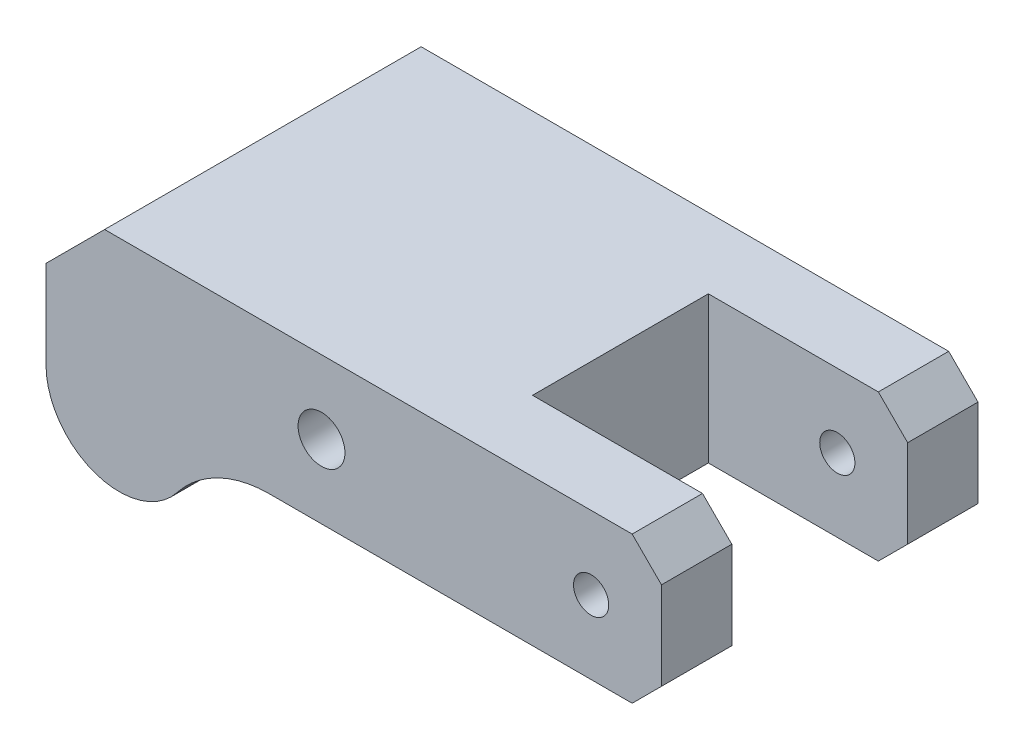
from build123d import *

# Parameters (mm, degrees)
ESTRUSIONE_ESTRUSIONE1_DEPTH = 27
SMUSSO1_SIZE                 = 10
SMUSSO2_SIZE                 = 5
SCHIZZO2_W                   = 34
SCHIZZO2_H                   = 30
TAGLIO_ESTRUSIONE1_DEPTH     = 86.181546674
SCHIZZO3_R                   = 3
SCHIZZO3_R_2                 = 4
TAGLIO_ESTRUSIONE2_DEPTH     = 94.067963842


with BuildPart() as part:
    # Schizzo1 → Estrusione-Estrusione1 (new, symmetric)
    with BuildSketch(Plane.XY):
        with BuildLine():
            Line((-71.558688457, 25), (33.441311543, 25))
            Line((33.441311543, 25), (33.441311543, 0))
            Line((33.441311543, 0), (-33.441311543, 0))
            ThreePointArc((-33.441311543, 0), (-42.211891736, -2.025659315), (-49.205851182, -7.692307692))
            ThreePointArc((-49.205851182, -7.692307692), (-63.126214368, -11.819696822), (-71.558688457, 0))
            Line((-71.558688457, 0), (-71.558688457, 25))
        make_face()
    extrude(amount=ESTRUSIONE_ESTRUSIONE1_DEPTH, both=True)

    # Smusso1
    smusso1_edges = [part.edges().sort_by_distance(p)[0] for p in [
        (-71.558688457, 25, 0),
    ]]
    chamfer(smusso1_edges, length=SMUSSO1_SIZE)

    # Smusso2
    smusso2_edges = [part.edges().sort_by_distance(p)[0] for p in [
        (33.441311543, 25, 0),
        (33.441311543, 0, 0),
    ]]
    chamfer(smusso2_edges, length=SMUSSO2_SIZE)

    # Schizzo2 → Taglio-Estrusione1 (cut, through all)
    with BuildSketch(Plane(origin=(0, 25, 0), x_dir=(1, 0, 0), z_dir=(0, 1, 0))):
        with Locations((16.441311543, 0)):
            Rectangle(SCHIZZO2_W, SCHIZZO2_H)
    extrude(amount=-TAGLIO_ESTRUSIONE1_DEPTH, mode=Mode.SUBTRACT)

    # Schizzo3 → Taglio-Estrusione2 (cut, through all)
    with BuildSketch(Plane.XY.offset(27)):
        with Locations((21.441311543, 12.5)):
            Circle(SCHIZZO3_R)
        with Locations((-24.558688457, 12.5)):
            Circle(SCHIZZO3_R_2)
    extrude(amount=-TAGLIO_ESTRUSIONE2_DEPTH, mode=Mode.SUBTRACT)


solid = part.part
